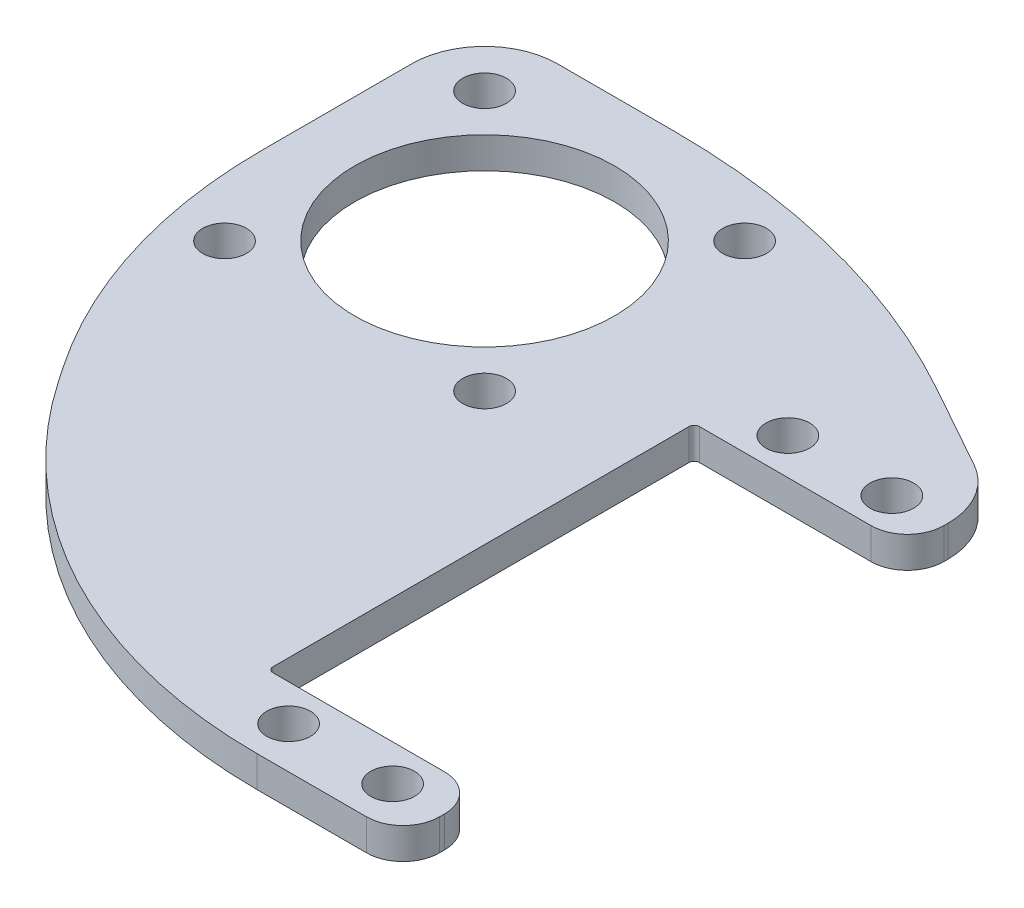
from build123d import *

# Parameters (mm, degrees)
SZKIC1_R                   = 2.1
SZKIC1_R_2                 = 12.5
WYCI_GNI_CIE_PROSTE1_DEPTH = 3
ZAOKR_GLENIE1_R            = 0.5
ZAOKR_GLENIE3_R            = 3.5
ZAOKR_GLENIE4_R            = 7
ZAOKR_GLENIE5_R            = 70
ZAOKR_GLENIE6_R            = 49
ZAOKR_GLENIE7_R            = 49
ZAOKR_GLENIE8_R            = 7


with BuildPart() as part:
    # Szkic1 → Wyciągnięcie proste1 (new body)
    with BuildSketch(Plane(origin=(0, 0, 0), x_dir=(-1, 0, 0), z_dir=(0, 1, 0))):
        Polygon((-18.25, -18.25), (18.25, -18.25), (18.25, 18.25), (-5.78812344, 53.629485271), (-35.78812344, 53.629485271), (-45.78812344, 53.629485271), (-45.78812344, 46.129485271), (-25.28812344, 46.129485271), (-25.28812344, 5.129485271), (-45.78812344, 5.129485271), (-45.78812344, -2.870514729), align=None)
        with Locations(Location((-40.78812344, 1.629485271, 0), (0, 0, 270))):
            Circle(SZKIC1_R, mode=Mode.SUBTRACT)
        with Locations(Location((-12.5, 12.5, 0), (0, 0, 270))):
            Circle(SZKIC1_R, mode=Mode.SUBTRACT)
        with Locations(Location((-30.78812344, 49.629485271, 0), (0, 0, 270))):
            Circle(SZKIC1_R, mode=Mode.SUBTRACT)
        with Locations(Location((-40.78812344, 49.629485271, 0), (0, 0, 270))):
            Circle(SZKIC1_R, mode=Mode.SUBTRACT)
        with Locations(Location((12.5, 12.5, 0), (0, 0, 270))):
            Circle(SZKIC1_R, mode=Mode.SUBTRACT)
        with Locations(Location((-30.78812344, 1.629485271, 0), (0, 0, 270))):
            Circle(SZKIC1_R, mode=Mode.SUBTRACT)
        with Locations(Location((12.5, -12.5, 0), (0, 0, 270))):
            Circle(SZKIC1_R, mode=Mode.SUBTRACT)
        with Locations(Location((-12.5, -12.5, 0), (0, 0, 270))):
            Circle(SZKIC1_R, mode=Mode.SUBTRACT)
        with Locations(Location((0, 0, 0), (0, 0, 270))):
            Circle(SZKIC1_R_2, mode=Mode.SUBTRACT)
    extrude(amount=WYCI_GNI_CIE_PROSTE1_DEPTH)

    # Zaokrąglenie1
    zaokr_glenie1_edges = [part.edges().sort_by_distance(p)[0] for p in [
        (25.28812344, 1.5, 5.129485271),
        (25.28812344, 1.5, 46.129485271),
    ]]
    fillet(zaokr_glenie1_edges, radius=ZAOKR_GLENIE1_R)

    # Zaokrąglenie3
    zaokr_glenie3_edges = [part.edges().sort_by_distance(p)[0] for p in [
        (45.78812344, 1.5, 5.129485271),
        (45.78812344, 1.5, 46.129485271),
        (45.78812344, 1.5, 53.629485271),
    ]]
    fillet(zaokr_glenie3_edges, radius=ZAOKR_GLENIE3_R)

    # Zaokrąglenie4
    zaokr_glenie4_edges = [part.edges().sort_by_distance(p)[0] for p in [
        (45.78812344, 1.5, -2.870514729),
    ]]
    fillet(zaokr_glenie4_edges, radius=ZAOKR_GLENIE4_R)

    # Zaokrąglenie5
    zaokr_glenie5_edges = [part.edges().sort_by_distance(p)[0] for p in [
        (18.25, 1.5, -18.25),
    ]]
    fillet(zaokr_glenie5_edges, radius=ZAOKR_GLENIE5_R)

    # Zaokrąglenie6
    zaokr_glenie6_edges = [part.edges().sort_by_distance(p)[0] for p in [
        (5.78812344, 1.5, 53.629485271),
    ]]
    fillet(zaokr_glenie6_edges, radius=ZAOKR_GLENIE6_R)

    # Zaokrąglenie7
    zaokr_glenie7_edges = [part.edges().sort_by_distance(p)[0] for p in [
        (-18.25, 1.5, 18.25),
    ]]
    fillet(zaokr_glenie7_edges, radius=ZAOKR_GLENIE7_R)

    # Zaokrąglenie8
    zaokr_glenie8_edges = [part.edges().sort_by_distance(p)[0] for p in [
        (-18.25, 1.5, -18.25),
    ]]
    fillet(zaokr_glenie8_edges, radius=ZAOKR_GLENIE8_R)


solid = part.part
